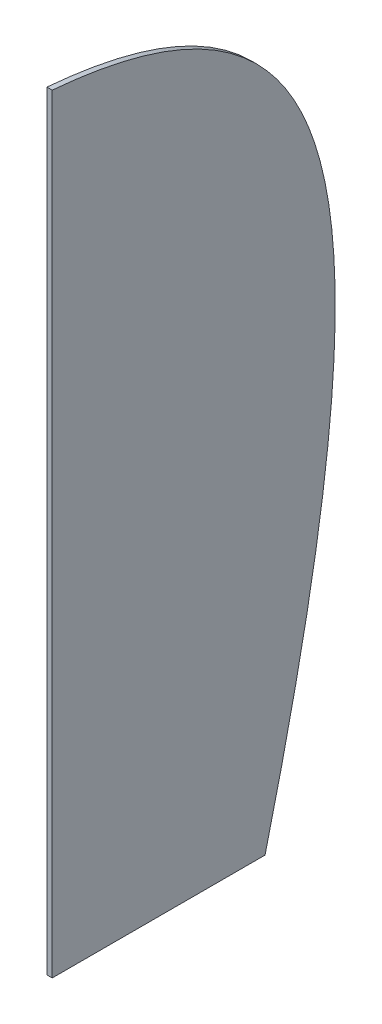
from build123d import *

# Parameters (mm, degrees)
EXTRUDE_1_DEPTH   = 0.5
MOVE_BODY_1_ANGLE = 180
MOVE_BODY_2_ANGLE = 90
MOVE_BODY_3_ANGLE = 90


with BuildPart() as part:
    # 草图1 → 凸台-拉伸1 (new, symmetric)
    with BuildSketch(Plane.XY):
        with BuildLine():
            Line((15, 0), (145, 0))
            add(Edge.make_bspline(
                [(0, -40.143966229), (96.105563962, -64.070119442), (140.053769682, -58.282483629), (145, 0)],
                knots=[0, 0, 0, 0, 1, 1, 1, 1], degree=3))
            Line((0, -40.143966229), (0, 0))
            Line((0, 0), (15, 0))
        make_face()
    extrude(amount=EXTRUDE_1_DEPTH, both=True)


with BuildPart() as part_1:
    # Move Body 1: moved
    add(part.part.rotate(Axis((0, 0, 0), (0, 1, 0)), MOVE_BODY_1_ANGLE))


with BuildPart() as part_2:
    # Move Body 2: moved
    add(part_1.part.rotate(Axis((0, 0, 0), (0, 0, -1)), MOVE_BODY_2_ANGLE))


with BuildPart() as part_3:
    # Move Body 3: moved
    add(part_2.part.rotate(Axis((0, 0, 0), (0, -1, 0)), MOVE_BODY_3_ANGLE))


solid = part_3.part
